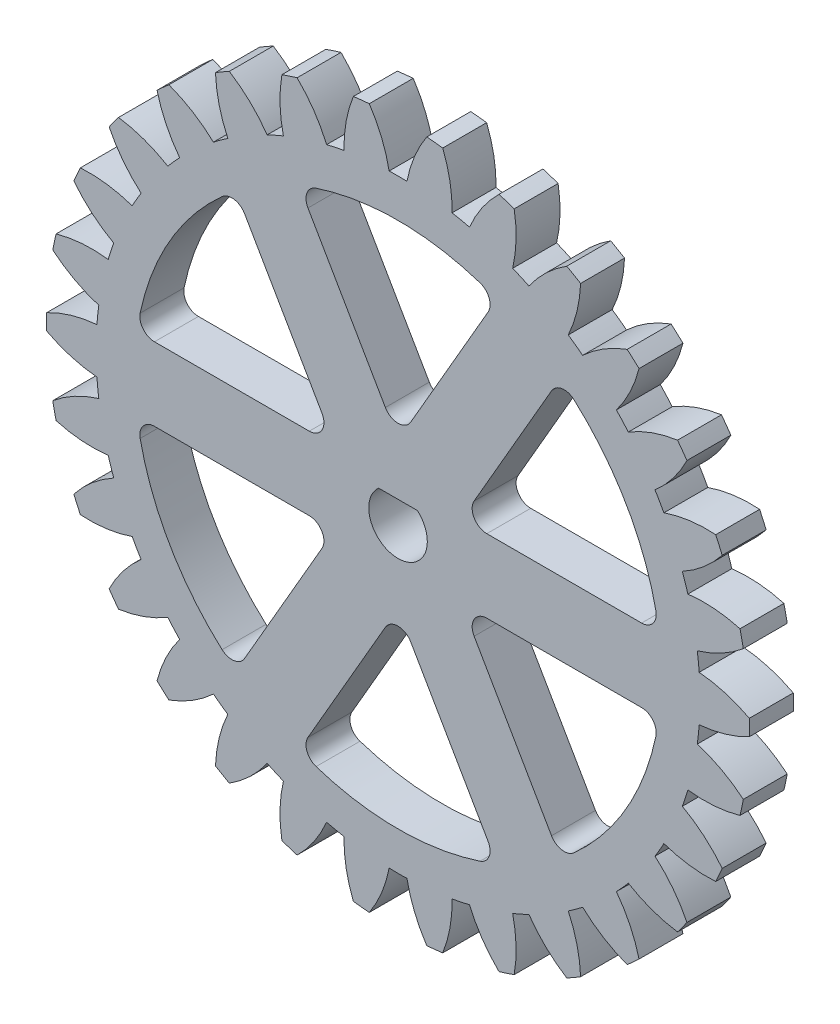
from build123d import *

# Parameters (mm, degrees)
SKETCH1_R                = 23.99999999999999
BOSS_EXTRUDE1_DEPTH      = 3
CUT_EXTRUDE1_DEPTH       = 35.07345007480163
CIRPATTERN1_COUNT        = 30
CUT_EXTRUDE2_DEPTH       = 35.01674497668011
FILLET1_R                = 1
CIRPATTERN2_COUNT        = 6
FILLET1_OF_CIRPATTERN2_R = 1
CUT_EXTRUDE3_DEPTH       = 35.01674497668011


with BuildPart() as part:
    # Sketch1 → Boss-Extrude1 (new body)
    with BuildSketch(Plane.XY):
        Circle(SKETCH1_R)
    extrude(amount=BOSS_EXTRUDE1_DEPTH)

    # Sketch2 → Cut-Extrude1 (cut, through all)
    with BuildSketch(Plane.XY.offset(3)):
        with BuildLine():
            ThreePointArc((-0.6078943285153203, 20.616039616894376), (1.26e-15, 20.62499999999999), (0.6078943285153203, 20.616039616894376))
            ThreePointArc((0.6078943285153203, 20.616039616894376), (1.1209300481563567, 22.335720311039616), (1.9649583180080459, 23.919425971550627))
            ThreePointArc((1.9649583180080459, 23.919425971550627), (1.47e-15, 23.999999999999993), (-1.9649583180080459, 23.919425971550627))
            ThreePointArc((-1.9649583180080459, 23.919425971550627), (-1.1209300481563567, 22.335720311039616), (-0.6078943285153203, 20.616039616894376))
        make_face()
    cut_extrude1 = extrude(amount=-CUT_EXTRUDE1_DEPTH, mode=Mode.SUBTRACT)

    # CirPattern1: Cut-Extrude1 ×30 about axis
    cirpattern1_axis = Axis((3e-15, -1.3e-16, 0), (0, 0, 1))
    for i in range(1, CIRPATTERN1_COUNT):
        add(cut_extrude1.rotate(cirpattern1_axis, i * 360 / CIRPATTERN1_COUNT), mode=Mode.SUBTRACT)

    # Sketch3 → Cut-Extrude2 (cut, through all)
    with BuildSketch(Plane.XY.offset(3)):
        with BuildLine():
            Line((0, 5), (-6.747708225526861, 16.687373481262927))
            ThreePointArc((-6.747708225526861, 16.687373481262927), (1.1e-15, 18), (6.747708225526861, 16.687373481262927))
            Line((6.747708225526861, 16.687373481262927), (0, 5))
        make_face()
    cut_extrude2 = extrude(amount=-CUT_EXTRUDE2_DEPTH, mode=Mode.SUBTRACT)

    # Fillet1
    fillet1_edges = [part.edges().sort_by_distance(p)[0] for p in [
        (6.747708225526861, 16.687373481262927, 1.5),
        (0, 5, 1.5),
        (-6.747708225526861, 16.687373481262927, 1.5),
    ]]
    fillet(fillet1_edges, radius=FILLET1_R)

    # CirPattern2: Cut-Extrude2 ×6 about axis
    cirpattern2_axis = Axis((8.9e-15, -4.3e-16, 0), (0, 0, 1))
    for i in range(1, CIRPATTERN2_COUNT):
        add(cut_extrude2.rotate(cirpattern2_axis, i * 360 / CIRPATTERN2_COUNT), mode=Mode.SUBTRACT)

    # Fillet1 of CirPattern2
    fillet1_of_cirpattern2_edges = [part.edges().sort_by_distance(p)[0] for p in [
        (-11.077835244449023, 14.187373481262934, 1.5),
        (-4.330127018922188, 2.4999999999999925, 1.5),
        (-17.825543469975887, 2.4999999999999805, 1.5),
        (-17.825543469975877, -2.4999999999999907, 1.5),
        (-4.33012701892218, -2.5000000000000075, 1.5),
        (-11.07783524444902, -14.187373481262947, 1.5),
        (-6.747708225526845, -16.687373481262927, 1.5),
        (1.718e-14, -5.000000000000001, 1.5),
        (6.7477082255268765, -16.687373481262927, 1.5),
        (11.077835244449036, -14.187373481262938, 1.5),
        (4.330127018922205, -2.499999999999995, 1.5),
        (17.8255434699759, -2.4999999999999885, 1.5),
        (17.825543469975894, 2.499999999999996, 1.5),
        (4.330127018922197, 2.500000000000008, 1.5),
        (11.077835244449032, 14.187373481262949, 1.5),
    ]]
    fillet(fillet1_of_cirpattern2_edges, radius=FILLET1_OF_CIRPATTERN2_R)

    # Sketch4 → Cut-Extrude3 (cut, through all)
    with BuildSketch(Plane.XY.offset(3)):
        with BuildLine():
            Line((-1.3228756555322954, 1.5), (1.3228756555322954, 1.5))
            ThreePointArc((1.3228756555322954, 1.5), (-3.7e-16, -2), (-1.3228756555322954, 1.5))
        make_face()
    extrude(amount=-CUT_EXTRUDE3_DEPTH, mode=Mode.SUBTRACT)


solid = part.part
